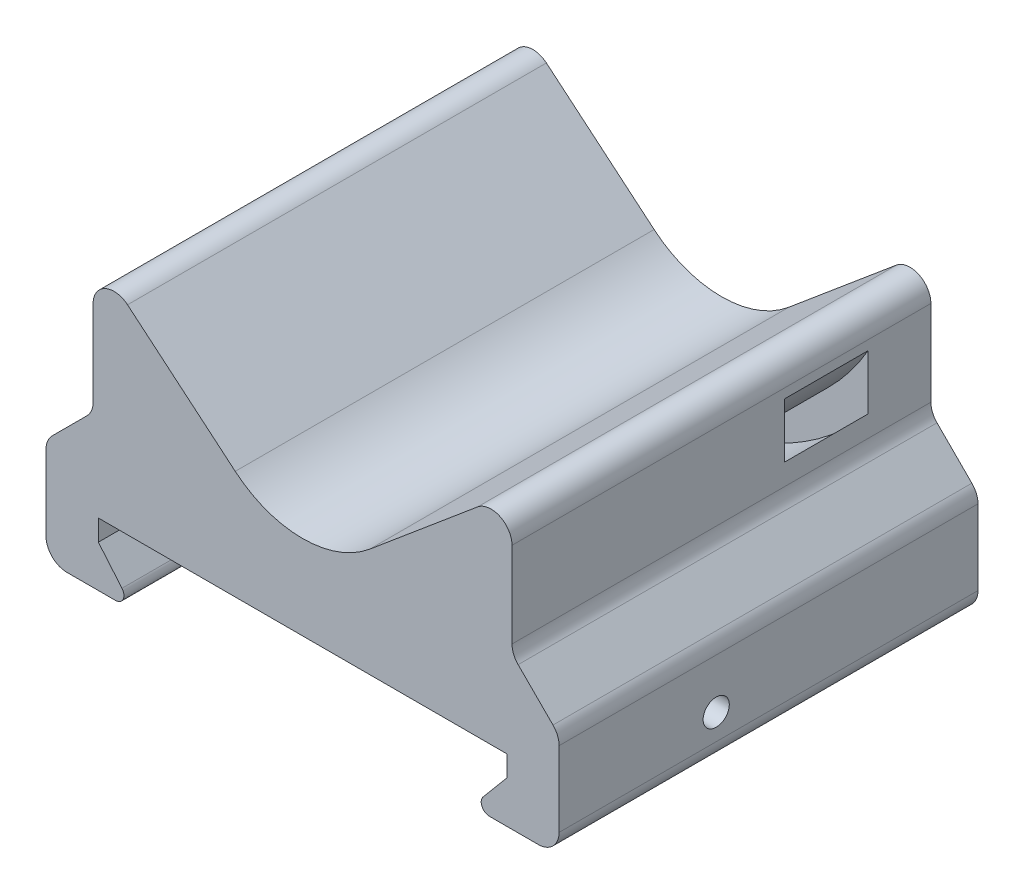
from build123d import *

# Parameters (mm, degrees)
BOSS_EXTRUDE1_DEPTH             = 40
SKETCH2_W                       = 8
SKETCH2_H                       = 3
M3X0_5_TAPPED_HOLE1_D           = 2.5
M3X0_5_TAPPED_HOLE1_CSINK_D     = 3.05
M3X0_5_TAPPED_HOLE1_CSINK_ANGLE = 90


with BuildPart() as part:
    # Sketch1 → Boss-Extrude1 (new body)
    with BuildSketch(Plane.XY):
        with BuildLine():
            Line((6.427876097, 10.393628462), (16.714424781, 19.025067669))
            ThreePointArc((16.714424781, 19.025067669), (18.845236523, 19.305594357), (20, 17.492978783))
            Line((20, 17.492978783), (20, 9.328427125))
            ThreePointArc((20, 9.328427125), (20.152240935, 8.56306026), (20.585786438, 7.914213562))
            Line((20.585786438, 7.914213562), (23.914213562, 4.585786438))
            ThreePointArc((23.914213562, 4.585786438), (24.347759065, 3.93693974), (24.5, 3.171572875))
            Line((24.5, 3.171572875), (24.5, -4))
            ThreePointArc((24.5, -4), (23.914213562, -5.414213562), (22.5, -6))
            Line((22.5, -6), (17.859207012, -6))
            ThreePointArc((17.859207012, -6), (17.134160782, -5.538094609), (17.246371457, -4.685769912))
            Line((17.246371457, -4.685769912), (19.5, -2))
            Line((19.5, -2), (19.5, 0))
            Line((19.5, 0), (-19.5, 0))
            Line((-19.5, 0), (-19.5, -2))
            Line((-19.5, -2), (-17.246371457, -4.685769912))
            ThreePointArc((-17.246371457, -4.685769912), (-17.134160782, -5.538094609), (-17.859207012, -6))
            Line((-17.859207012, -6), (-22.5, -6))
            ThreePointArc((-22.5, -6), (-23.914213562, -5.414213562), (-24.5, -4))
            Line((-24.5, -4), (-24.5, 3.171572875))
            ThreePointArc((-24.5, 3.171572875), (-24.347759065, 3.93693974), (-23.914213562, 4.585786438))
            Line((-23.914213562, 4.585786438), (-20.585786438, 7.914213562))
            ThreePointArc((-20.585786438, 7.914213562), (-20.152240935, 8.56306026), (-20, 9.328427125))
            Line((-20, 9.328427125), (-20, 17.492978783))
            ThreePointArc((-20, 17.492978783), (-18.845236523, 19.305594357), (-16.714424781, 19.025067669))
            Line((-16.714424781, 19.025067669), (-6.427876097, 10.393628462))
            ThreePointArc((-6.427876097, 10.393628462), (0, 8.054072893), (6.427876097, 10.393628462))
        make_face()
    extrude(amount=BOSS_EXTRUDE1_DEPTH)

    # Sketch2 → Cut-Revolve1 (revolve, cut)
    with BuildSketch(Plane(origin=(0, 0, 0), x_dir=(0, 0, -1), z_dir=(1, 0, 0))):
        with Locations((-10, 3.5)):
            Rectangle(SKETCH2_W, SKETCH2_H)
        with Locations((-50, 3.5)):
            Rectangle(SKETCH2_W, SKETCH2_H)
        with Locations((-90, 3.5)):
            Rectangle(SKETCH2_W, SKETCH2_H)
    revolve(axis=Axis((0, 28.054072893, 29.353848425), (0, 0, -1)), mode=Mode.SUBTRACT)

    # M3x0.5 Tapped Hole1 (through all)
    with Locations(Plane.ZY.offset(24.5)):
        with Locations((25, -1.555540573), (75, -1.555540573)):
            CounterSinkHole(M3X0_5_TAPPED_HOLE1_D / 2, M3X0_5_TAPPED_HOLE1_CSINK_D / 2, counter_sink_angle=M3X0_5_TAPPED_HOLE1_CSINK_ANGLE)


solid = part.part
